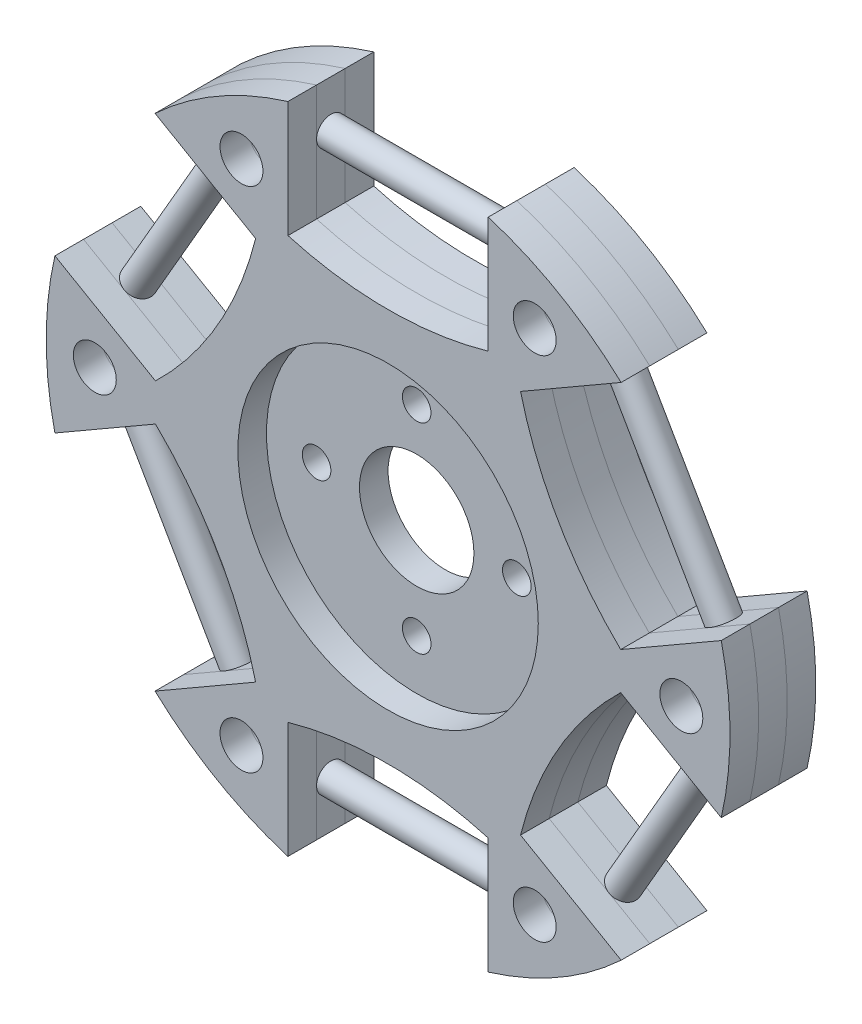
from build123d import *

# Parameters (mm, degrees)
SKETCH_1_R               = 25.4
SKETCH_1_R_2             = 10.5
EXTRUDE_1_DEPTH          = 2
SKETCH_2_R               = 25.4
SKETCH_2_R_2             = 4
EXTRUDE_2_DEPTH          = 2
SKETCH_3_R               = 25.4
SKETCH_3_R_2             = 10.5
EXTRUDE_3_DEPTH          = 2
CUT_EXTRUDE_START        = -20.5
CUT_EXTRUDE_1_DEPTH      = 20.5
SKETCH_5_R               = 1.5
CUT_EXTRUDE_2_DEPTH      = 20.5
SKETCH_6_R               = 1
EXTRUDE_4_DEPTH          = 14
PATTERN_CIRCULAR_1_COUNT = 6
SKETCH_7_R               = 1
CUT_EXTRUDE_3_DEPTH      = 14
SKETCH_8_R               = 33.9
SKETCH_8_R_2             = 23.9
CUT_EXTRUDE_1_2_DEPTH    = 10


with BuildPart() as part:
    # 草图1 → 凸台-拉伸1 (new body)
    with BuildSketch(Plane.XY):
        Circle(SKETCH_1_R)
        Circle(SKETCH_1_R_2, mode=Mode.SUBTRACT)
    extrude(amount=EXTRUDE_1_DEPTH)


with BuildPart() as body_2:
    # 草图2 → 凸台-拉伸2 (new body)
    with BuildSketch(Plane.XY.offset(2)):
        Circle(SKETCH_2_R)
        Circle(SKETCH_2_R_2, mode=Mode.SUBTRACT)
    extrude(amount=EXTRUDE_2_DEPTH)


with BuildPart() as body_3:
    # 草图3 → 凸台-拉伸3 (new body)
    with BuildSketch(Plane.XY.offset(4)):
        Circle(SKETCH_3_R)
        Circle(SKETCH_3_R_2, mode=Mode.SUBTRACT)
    extrude(amount=EXTRUDE_3_DEPTH)


with BuildPart() as cut_extrude_1_tool:
    # 草图4 → Cut-Extrude 1 (new body)
    with BuildSketch(Plane.XY.offset(6).offset(CUT_EXTRUDE_START)):
        with BuildLine():
            Line((9.259682334, 13.428983857), (17.645212224, 18.270371796))
            ThreePointArc((17.645212224, 18.270371796), (21.997045256, 12.7), (24.645212224, 6.146016143))
            Line((24.645212224, 6.146016143), (16.259682334, 1.304628204))
            ThreePointArc((16.259682334, 1.304628204), (11.907849302, 6.875), (9.259682334, 13.428983857))
        make_face()
        with BuildLine():
            Line((7, 14.733612061), (7, 24.416387939))
            ThreePointArc((7, 24.416387939), (0, 25.4), (-7, 24.416387939))
            Line((-7, 24.416387939), (-7, 14.733612061))
            ThreePointArc((-7, 14.733612061), (0, 13.75), (7, 14.733612061))
        make_face()
        with BuildLine():
            Line((16.259682334, -1.304628204), (24.645212224, -6.146016143))
            ThreePointArc((24.645212224, -6.146016143), (21.997045256, -12.7), (17.645212224, -18.270371796))
            Line((17.645212224, -18.270371796), (9.259682334, -13.428983857))
            ThreePointArc((9.259682334, -13.428983857), (11.907849302, -6.875), (16.259682334, -1.304628204))
        make_face()
        with BuildLine():
            Line((7, -14.733612061), (7, -24.416387939))
            ThreePointArc((7, -24.416387939), (0, -25.4), (-7, -24.416387939))
            Line((-7, -24.416387939), (-7, -14.733612061))
            ThreePointArc((-7, -14.733612061), (0, -13.75), (7, -14.733612061))
        make_face()
        with BuildLine():
            Line((-9.259682334, -13.428983857), (-17.645212224, -18.270371796))
            ThreePointArc((-17.645212224, -18.270371796), (-21.997045256, -12.7), (-24.645212224, -6.146016143))
            Line((-24.645212224, -6.146016143), (-16.259682334, -1.304628204))
            ThreePointArc((-16.259682334, -1.304628204), (-11.907849302, -6.875), (-9.259682334, -13.428983857))
        make_face()
        with BuildLine():
            Line((-16.259682334, 1.304628204), (-24.645212224, 6.146016143))
            ThreePointArc((-24.645212224, 6.146016143), (-21.997045256, 12.7), (-17.645212224, 18.270371796))
            Line((-17.645212224, 18.270371796), (-9.259682334, 13.428983857))
            ThreePointArc((-9.259682334, 13.428983857), (-11.907849302, 6.875), (-16.259682334, 1.304628204))
        make_face()
    extrude(amount=CUT_EXTRUDE_1_DEPTH)


with BuildPart() as part_1:
    add(part.part)

    # Cut-Extrude 1: cut by cut_extrude_1_tool
    add(cut_extrude_1_tool.part, mode=Mode.SUBTRACT)


with BuildPart() as body_2_1:
    add(body_2.part)

    # Cut-Extrude 1: cut by cut_extrude_1_tool
    add(cut_extrude_1_tool.part, mode=Mode.SUBTRACT)


with BuildPart() as body_3_1:
    add(body_3.part)

    # Cut-Extrude 1: cut by cut_extrude_1_tool
    add(cut_extrude_1_tool.part, mode=Mode.SUBTRACT)


with BuildPart() as cut_extrude_2_tool:
    # 草图5 → 切除-拉伸2 (new body)
    with BuildSketch(Plane.XY.offset(6)):
        with Locations((10.25, 17.753520778)):
            Circle(SKETCH_5_R)
        with Locations((20.5, 0)):
            Circle(SKETCH_5_R)
        with Locations((10.25, -17.753520778)):
            Circle(SKETCH_5_R)
        with Locations((-10.25, -17.753520778)):
            Circle(SKETCH_5_R)
        with Locations((-20.5, 0)):
            Circle(SKETCH_5_R)
        with Locations((-10.25, 17.753520778)):
            Circle(SKETCH_5_R)
    extrude(amount=-CUT_EXTRUDE_2_DEPTH)


with BuildPart() as part_2:
    add(part_1.part)

    # 切除-拉伸2: cut by cut_extrude_2_tool
    add(cut_extrude_2_tool.part, mode=Mode.SUBTRACT)


with BuildPart() as body_2_2:
    add(body_2_1.part)

    # 切除-拉伸2: cut by cut_extrude_2_tool
    add(cut_extrude_2_tool.part, mode=Mode.SUBTRACT)

    # 草图6 → 凸台-拉伸4 (add)
    with BuildSketch(Plane(origin=(-7, 0, 0), x_dir=(0, 0, -1), z_dir=(1, 0, 0))):
        with Locations(Location((-3, 19.575, 0), (0, 0, 180))):
            Circle(SKETCH_6_R)
    extrude_4 = extrude(amount=EXTRUDE_4_DEPTH)

    # 阵列(圆周)1: 凸台-拉伸4 ×6 about axis
    pattern_circular_1_axis = Axis((0, 0, 6), (0, 0, 1))
    for i in range(1, PATTERN_CIRCULAR_1_COUNT):
        add(extrude_4.rotate(pattern_circular_1_axis, i * 360 / PATTERN_CIRCULAR_1_COUNT))

    # 草图7 → 切除-拉伸3 (cut)
    with BuildSketch(Plane.XY.offset(4)):
        with Locations((0, 7)):
            Circle(SKETCH_7_R)
        with Locations((7, 0)):
            Circle(SKETCH_7_R)
        with Locations((0, -7)):
            Circle(SKETCH_7_R)
        with Locations((-7, 0)):
            Circle(SKETCH_7_R)
    extrude(amount=-CUT_EXTRUDE_3_DEPTH, mode=Mode.SUBTRACT)


with BuildPart() as body_3_2:
    add(body_3_1.part)

    # 切除-拉伸2: cut by cut_extrude_2_tool
    add(cut_extrude_2_tool.part, mode=Mode.SUBTRACT)


with BuildPart() as cut_extrude_1_2_tool:
    # 草图8 → Cut-Extrude 1 2 (new body)
    with BuildSketch(Plane.XY.offset(6)):
        Circle(SKETCH_8_R)
        Circle(SKETCH_8_R_2, mode=Mode.SUBTRACT)
    extrude(amount=-CUT_EXTRUDE_1_2_DEPTH)


with BuildPart() as part_3:
    add(part_2.part)

    # Cut-Extrude 1 2: cut by cut_extrude_1_2_tool
    add(cut_extrude_1_2_tool.part, mode=Mode.SUBTRACT)


with BuildPart() as body_2_3:
    add(body_2_2.part)

    # Cut-Extrude 1 2: cut by cut_extrude_1_2_tool
    add(cut_extrude_1_2_tool.part, mode=Mode.SUBTRACT)


with BuildPart() as body_3_3:
    add(body_3_2.part)

    # Cut-Extrude 1 2: cut by cut_extrude_1_2_tool
    add(cut_extrude_1_2_tool.part, mode=Mode.SUBTRACT)


solid = Compound([part_3.part, body_2_3.part, body_3_3.part])
